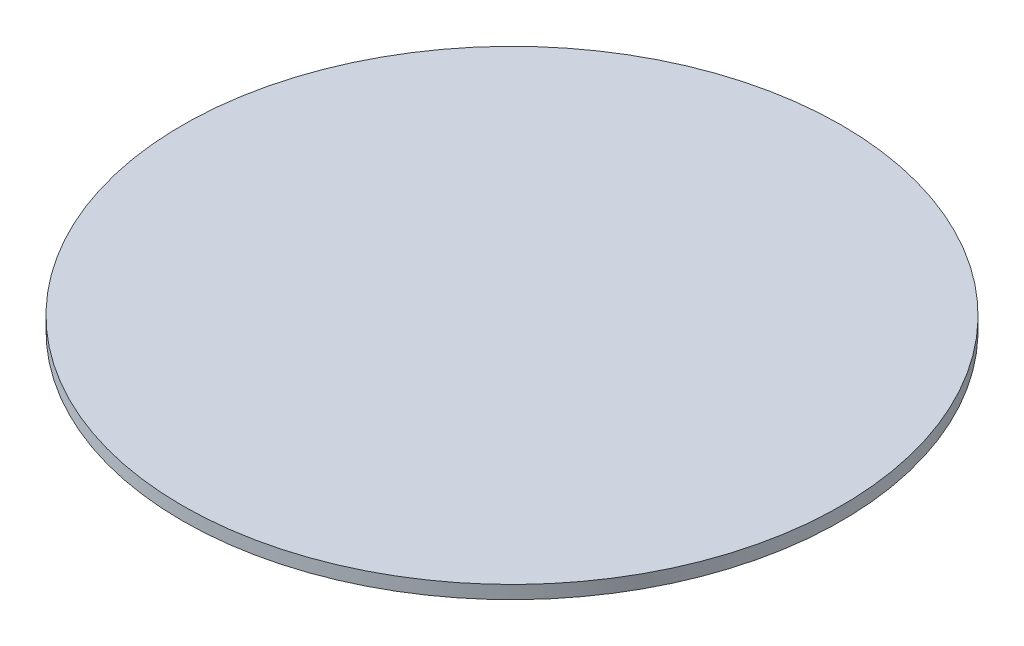
from build123d import *

# Parameters (mm, degrees)
SKETCH1_R           = 300
BOSS_EXTRUDE1_DEPTH = 12
SKETCH2_R           = 280
SKETCH2_R_2         = 275
CUT_EXTRUDE1_DEPTH  = 6


with BuildPart() as part:
    # Sketch1 → Boss-Extrude1 (new body)
    with BuildSketch(Plane(origin=(0, 0, 0), x_dir=(1, 0, 0), z_dir=(0, 1, 0))):
        with Locations(Location((0, 0, 0), (0, 0, 270))):
            Circle(SKETCH1_R)
    extrude(amount=BOSS_EXTRUDE1_DEPTH)

    # Sketch2 → Cut-Extrude1 (cut)
    with BuildSketch(Plane.XZ):
        with Locations(Location((0, 0, 0), (0, 0, 270))):
            Circle(SKETCH2_R)
        with Locations(Location((0, 0, 0), (0, 0, 270))):
            Circle(SKETCH2_R_2, mode=Mode.SUBTRACT)
    extrude(amount=-CUT_EXTRUDE1_DEPTH, mode=Mode.SUBTRACT)


solid = part.part
